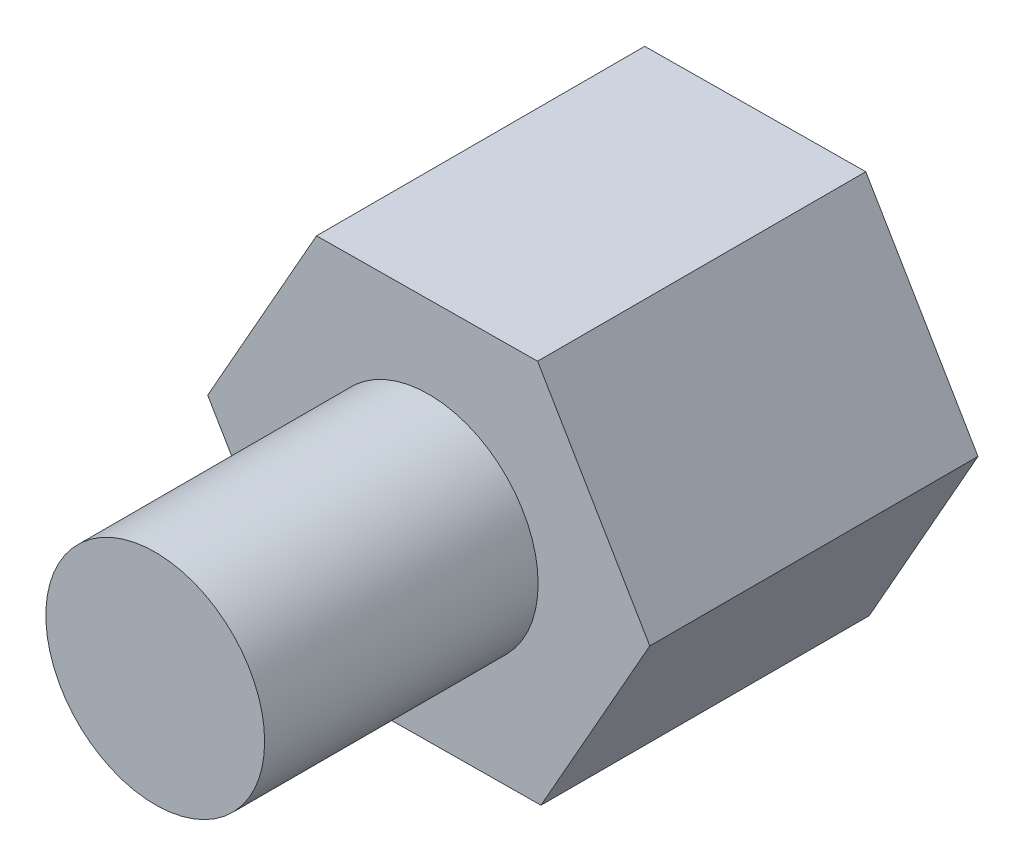
from build123d import *

# Parameters (mm, degrees)
SKETCH_1_R      = 2
EXTRUDE_1_DEPTH = 6
SKETCH_3_R      = 2
EXTRUDE_2_DEPTH = 5


with BuildPart() as part:
    # 草图1 → 凸台-拉伸1 (new body)
    with BuildSketch(Plane.XY):
        Polygon((2.051456248, -3.482077052), (4.041295309, 0.035574699), (1.989839061, 3.517651751), (-2.051456248, 3.482077052), (-4.041295309, -0.035574699), (-1.989839061, -3.517651751), align=None)
        Circle(SKETCH_1_R, mode=Mode.SUBTRACT)
    extrude(amount=EXTRUDE_1_DEPTH)


with BuildPart() as body_2:
    # 草图3 → 凸台-拉伸2 (new body)
    with BuildSketch(Plane.XY.offset(6)):
        Circle(SKETCH_3_R)
    extrude(amount=EXTRUDE_2_DEPTH)


solid = Compound([part.part, body_2.part])
